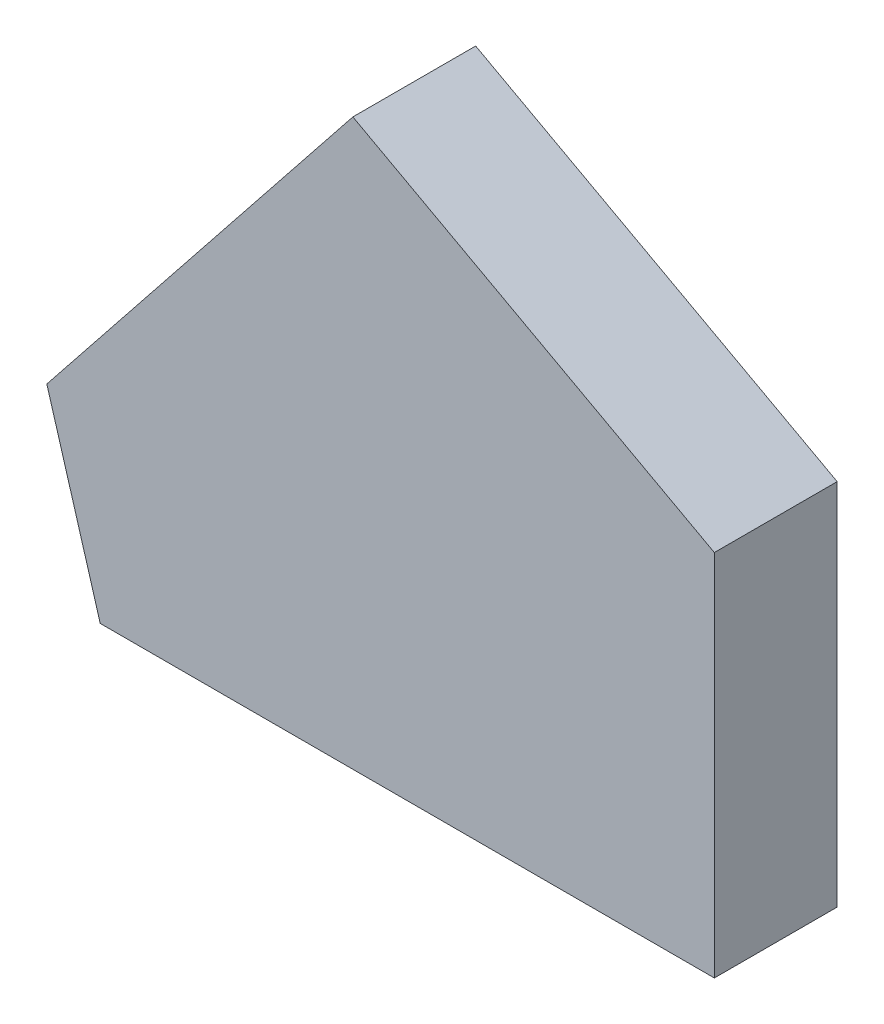
from build123d import *

# Parameters (mm, degrees)
SALIENTE_EXTRUIR2_DEPTH = 10


with BuildPart() as part:
    # Croquis7 → Saliente-Extruir2 (new body)
    with BuildSketch(Plane.XY):
        Polygon((0, 30), (0, 0), (-50, 0), (-54.348543383, 14.708718408), (-29.431567316, 46), align=None)
    extrude(amount=SALIENTE_EXTRUIR2_DEPTH)


solid = part.part
